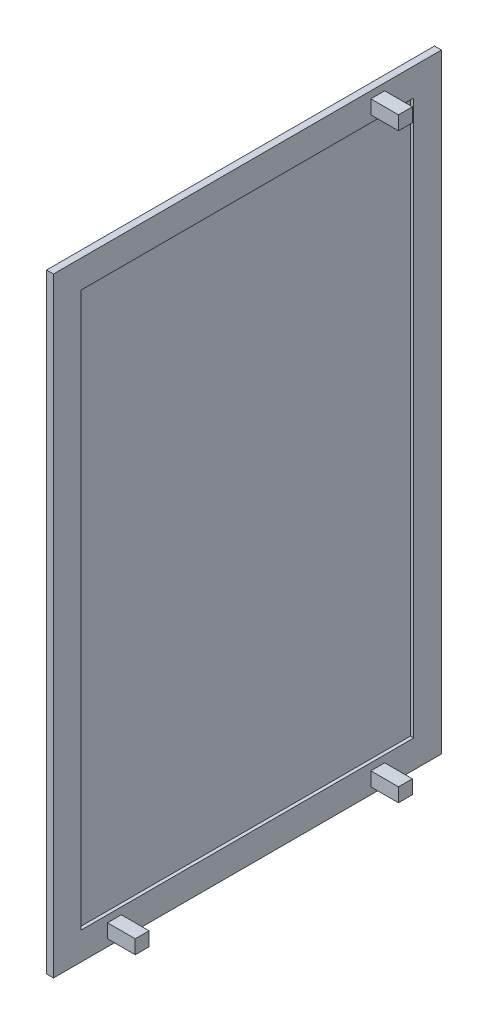
from build123d import *

# Parameters (mm, degrees)
SKETCH1_W           = 70
SKETCH1_H           = 110
BOSS_EXTRUDE1_DEPTH = 1.25
SKETCH2_W           = 2.5
SKETCH2_H           = 2.5
BOSS_EXTRUDE2_DEPTH = 5
SKETCH3_W           = 60
SKETCH3_H           = 100
CUT_EXTRUDE1_DEPTH  = 0.6


with BuildPart() as part:
    # Sketch1 → Boss-Extrude1 (new body)
    with BuildSketch(Plane(origin=(0, 0, 0), x_dir=(0, 0, -1), z_dir=(1, 0, 0))):
        with Locations((35, 55)):
            Rectangle(SKETCH1_W, SKETCH1_H)
    extrude(amount=BOSS_EXTRUDE1_DEPTH)

    # Sketch2 → Boss-Extrude2 (add)
    with BuildSketch(Plane(origin=(1.25, 0, 0), x_dir=(0, 0, -1), z_dir=(1, 0, 0))):
        with Locations((58.5, 107.5)):
            Rectangle(SKETCH2_W, SKETCH2_H)
        with Locations((11, 2.5)):
            Rectangle(SKETCH2_W, SKETCH2_H)
        with Locations((58.5, 2.5)):
            Rectangle(SKETCH2_W, SKETCH2_H)
    extrude(amount=BOSS_EXTRUDE2_DEPTH)

    # Sketch3 → Cut-Extrude1 (cut)
    with BuildSketch(Plane(origin=(1.25, 0, 0), x_dir=(0, 0, -1), z_dir=(1, 0, 0))):
        with Locations((35, 55)):
            Rectangle(SKETCH3_W, SKETCH3_H)
    extrude(amount=-CUT_EXTRUDE1_DEPTH, mode=Mode.SUBTRACT)


solid = part.part
